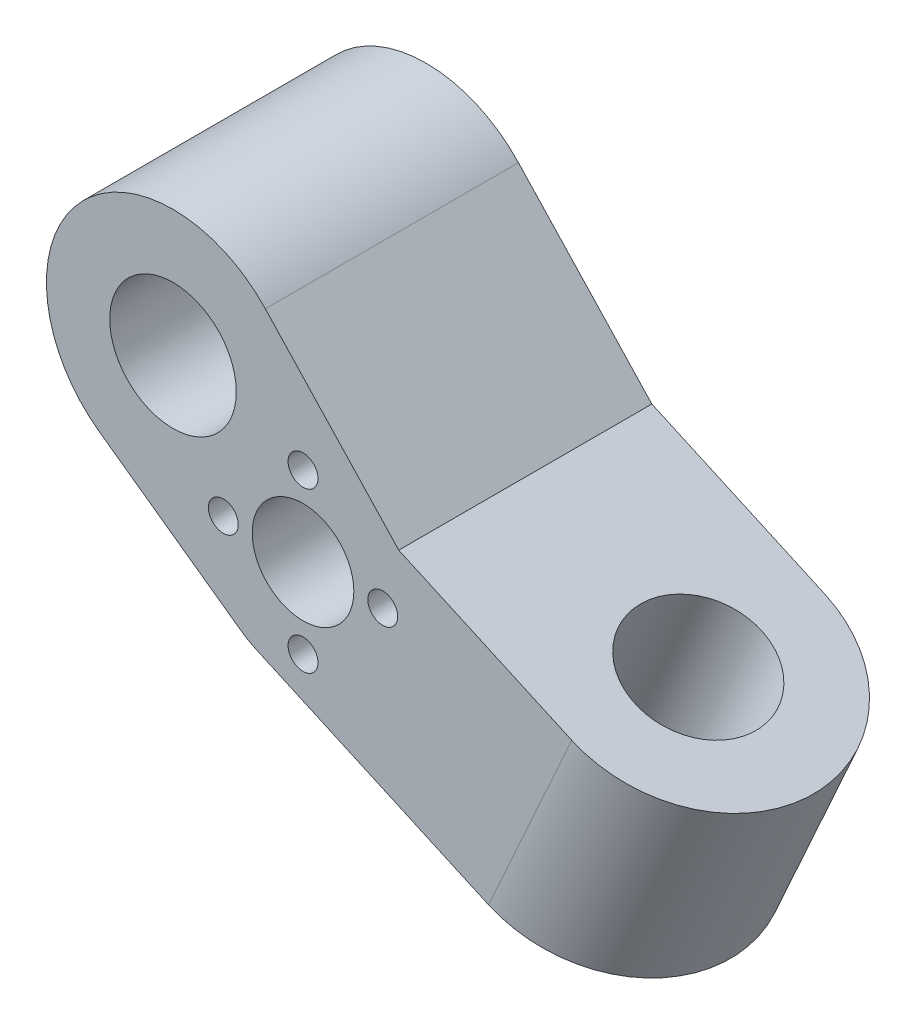
from build123d import *

# Parameters (mm, degrees)
SKETCH1_R           = 1.5
SKETCH1_R_2         = 5.1
BOSS_EXTRUDE1_DEPTH = 25.4
SKETCH2_R           = 6.35
CUT_EXTRUDE1_DEPTH  = 20.273760375


with BuildPart() as part:
    # Sketch1 → Boss-Extrude1 (new body)
    with BuildSketch(Plane.XY):
        with BuildLine():
            Line((-36.459452571, -57.227643835), (-65.396139663, -44.161250294))
            Line((-65.396139663, -44.161250294), (-78.782055326, -29.879648176))
            ThreePointArc((-78.782055326, -29.879648176), (-97.599291983, -30.194079121), (-95.442610221, -48.889960647))
            Line((-95.442610221, -48.889960647), (-81.404627284, -58.943195702))
            ThreePointArc((-81.404627284, -58.943195702), (-80.492497638, -59.530606995), (-79.526939494, -60.025308914))
            Line((-79.526939494, -60.025308914), (-44.802914985, -75.704981163))
            Line((-44.802914985, -75.704981163), (-36.459452571, -57.227643835))
        make_face()
        with Locations((-75, -58)):
            Circle(SKETCH1_R, mode=Mode.SUBTRACT)
        with BuildLine():
            ThreePointArc((-81.698176902, -38.564634701), (-82.104807051, -40.800446591), (-83.272619362, -42.74991249))
            ThreePointArc((-83.272619362, -42.74991249), (-93.991546754, -36.32882281), (-81.698176902, -38.564634701))
        make_face(mode=Mode.SUBTRACT)
        with Locations((-83, -50)):
            Circle(SKETCH1_R, mode=Mode.SUBTRACT)
        with Locations((-75, -50)):
            Circle(SKETCH1_R_2, mode=Mode.SUBTRACT)
        with Locations((-75, -42)):
            Circle(SKETCH1_R, mode=Mode.SUBTRACT)
        with Locations((-67, -50)):
            Circle(SKETCH1_R, mode=Mode.SUBTRACT)
    extrude(amount=BOSS_EXTRUDE1_DEPTH)

    # Sketch2 → Cut-Extrude1 (cut)
    with BuildSketch(Plane(origin=(-27.639567431, -61.210272872, 0), x_dir=(0.9113917194185279, -0.41153995404497395, 0), z_dir=(0.411539954044974, 0.911391719418528, 0))):
        with BuildLine():
            ThreePointArc((-22.377381254, 0), (-13.397125133, -3.719743879), (-9.677381254, -12.7))
            Line((-9.677381254, -12.7), (-9.677381254, 0))
            Line((-9.677381254, 0), (-22.377381254, 0))
        make_face()
        with BuildLine():
            ThreePointArc((-9.677381254, -12.7), (-13.397125133, -21.680256121), (-22.377381254, -25.4))
            Line((-22.377381254, -25.4), (-9.677381254, -25.4))
            Line((-9.677381254, -25.4), (-9.677381254, -12.7))
        make_face()
        with Locations(Location((-22.377381254, -12.7, 0), (0, 0, 180))):
            Circle(SKETCH2_R)
    extrude(amount=-CUT_EXTRUDE1_DEPTH, mode=Mode.SUBTRACT)


solid = part.part
